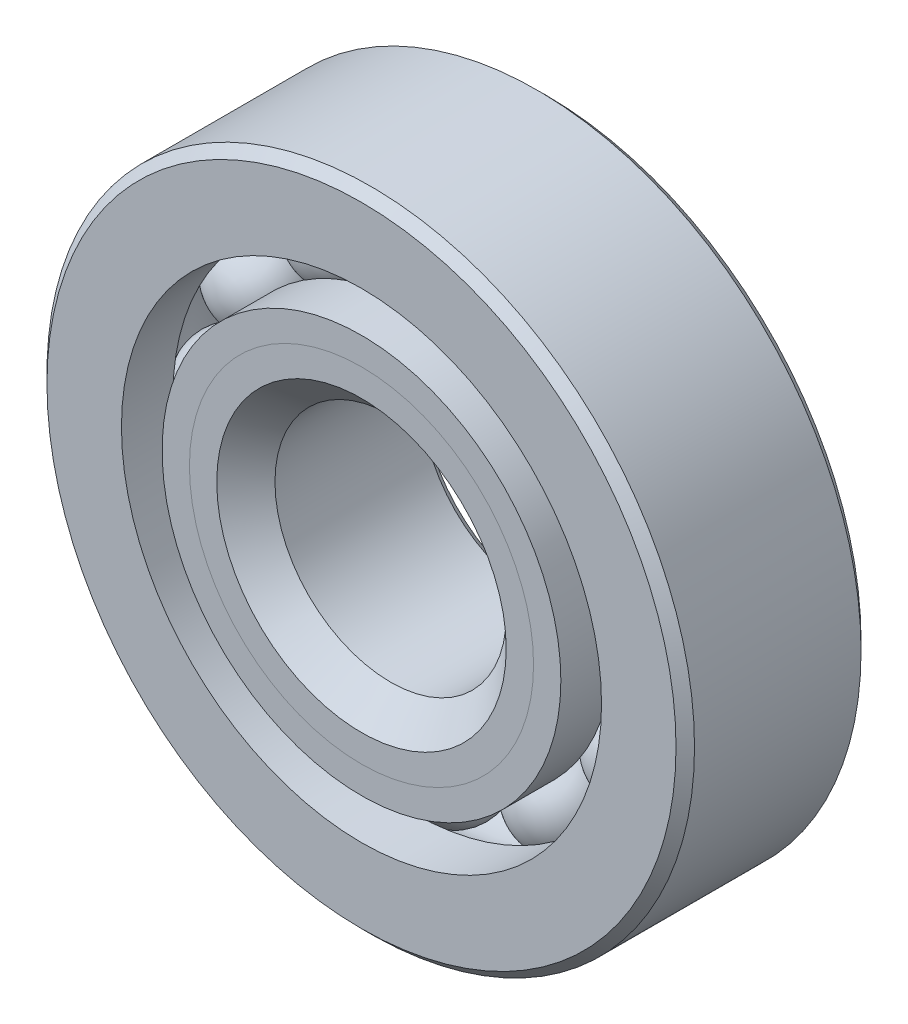
from build123d import *

# Parameters (mm, degrees)
CIRPATTERN1_COUNT = 12


with BuildPart() as part:
    # Sketch1 → Revolve1 (revolve)
    with BuildSketch(Plane(origin=(0, 0, 0), x_dir=(0, 0, -1), z_dir=(1, 0, 0))):
        with BuildLine():
            Line((2.8575, 11.1125), (-2.8575, 11.1125))
            Line((-2.8575, 11.1125), (-3.175, 10.795))
            Line((-3.175, 10.795), (-3.175, 8.238427198))
            Line((-3.175, 8.238427198), (-1.411111111, 8.238427198))
            ThreePointArc((-1.411111111, 8.238427198), (0, 9.114843052), (1.411111111, 8.238427198))
            Line((1.411111111, 8.238427198), (3.175, 8.238427198))
            Line((3.175, 8.238427198), (3.175, 10.795))
            Line((3.175, 10.795), (2.8575, 11.1125))
        make_face()
    revolve(axis=Axis((0, 0, 3.175), (0, 0, -1)))


with BuildPart() as body_2:
    # Sketch2 → Revolve2 (revolve)
    with BuildSketch(Plane(origin=(0, 0, 0), x_dir=(0, 0, -1), z_dir=(1, 0, 0))):
        with BuildLine():
            Line((-3.175, 6.842822802), (-1.411111111, 6.842822802))
            ThreePointArc((-1.411111111, 6.842822802), (-0.830562959, 6.203341318), (0, 5.966406948))
            Line((0, 5.966406948), (0, 4.967578474))
            Line((0, 4.967578474), (-2.237377836, 4.967578474))
            Line((-2.237377836, 4.967578474), (-3.175, 5.905200638))
            Line((-3.175, 5.905200638), (-3.175, 6.842822802))
        make_face()
    revolve(axis=Axis((0, 0, 3.175), (0, 0, -1)))


with BuildPart() as body_3:
    # Sketch3 → Revolve3 (revolve)
    with BuildSketch(Plane(origin=(0, 0, 0), x_dir=(0, 0, -1), z_dir=(1, 0, 0))):
        with BuildLine():
            Line((-3.175, 5.905200638), (-2.237377836, 4.967578474))
            Line((-2.237377836, 4.967578474), (0, 4.967578474))
            Line((0, 4.967578474), (0, 5.966406948))
            ThreePointArc((0, 5.966406948), (0.830562959, 6.203341318), (1.411111111, 6.842822802))
            Line((1.411111111, 6.842822802), (3.175, 6.842822802))
            Line((3.175, 6.842822802), (3.175, 4.28625))
            Line((3.175, 4.28625), (2.8575, 3.96875))
            Line((2.8575, 3.96875), (-2.176171526, 3.96875))
            Line((-2.176171526, 3.96875), (-3.175, 4.967578474))
            Line((-3.175, 4.967578474), (-3.175, 5.905200638))
        make_face()
    revolve(axis=Axis((0, 0, 3.175), (0, 0, -1)))


with BuildPart() as body_4:
    # Sketch4 → Revolve4 (revolve)
    with BuildSketch(Plane(origin=(0, 0, 0), x_dir=(0, 0, -1), z_dir=(1, 0, 0))):
        with BuildLine():
            Line((-1.574218052, 7.540625), (1.574218052, 7.540625))
            ThreePointArc((1.574218052, 7.540625), (0, 9.114843052), (-1.574218052, 7.540625))
        make_face()
    revolve(axis=Axis((0, 7.540625, 1.574218052), (0, 0, -1)))


with BuildPart() as cirpattern1_1:
    # CirPattern1: pattern copy
    add(body_4.part.rotate(Axis((0, 0, -3.175), (0, 0, 1)), 1 * 360 / CIRPATTERN1_COUNT))


with BuildPart() as cirpattern1_2:
    # CirPattern1: pattern copy
    add(body_4.part.rotate(Axis((0, 0, -3.175), (0, 0, 1)), 2 * 360 / CIRPATTERN1_COUNT))


with BuildPart() as cirpattern1_3:
    # CirPattern1: pattern copy
    add(body_4.part.rotate(Axis((0, 0, -3.175), (0, 0, 1)), 3 * 360 / CIRPATTERN1_COUNT))


with BuildPart() as cirpattern1_4:
    # CirPattern1: pattern copy
    add(body_4.part.rotate(Axis((0, 0, -3.175), (0, 0, 1)), 4 * 360 / CIRPATTERN1_COUNT))


with BuildPart() as cirpattern1_5:
    # CirPattern1: pattern copy
    add(body_4.part.rotate(Axis((0, 0, -3.175), (0, 0, 1)), 5 * 360 / CIRPATTERN1_COUNT))


with BuildPart() as cirpattern1_6:
    # CirPattern1: pattern copy
    add(body_4.part.rotate(Axis((0, 0, -3.175), (0, 0, 1)), 6 * 360 / CIRPATTERN1_COUNT))


with BuildPart() as cirpattern1_7:
    # CirPattern1: pattern copy
    add(body_4.part.rotate(Axis((0, 0, -3.175), (0, 0, 1)), 7 * 360 / CIRPATTERN1_COUNT))


with BuildPart() as cirpattern1_8:
    # CirPattern1: pattern copy
    add(body_4.part.rotate(Axis((0, 0, -3.175), (0, 0, 1)), 8 * 360 / CIRPATTERN1_COUNT))


with BuildPart() as cirpattern1_9:
    # CirPattern1: pattern copy
    add(body_4.part.rotate(Axis((0, 0, -3.175), (0, 0, 1)), 9 * 360 / CIRPATTERN1_COUNT))


with BuildPart() as cirpattern1_10:
    # CirPattern1: pattern copy
    add(body_4.part.rotate(Axis((0, 0, -3.175), (0, 0, 1)), 10 * 360 / CIRPATTERN1_COUNT))


with BuildPart() as cirpattern1_11:
    # CirPattern1: pattern copy
    add(body_4.part.rotate(Axis((0, 0, -3.175), (0, 0, 1)), 11 * 360 / CIRPATTERN1_COUNT))


solid = Compound([part.part, body_2.part, body_3.part, body_4.part, cirpattern1_1.part, cirpattern1_2.part, cirpattern1_3.part, cirpattern1_4.part, cirpattern1_5.part, cirpattern1_6.part, cirpattern1_7.part, cirpattern1_8.part, cirpattern1_9.part, cirpattern1_10.part, cirpattern1_11.part])
